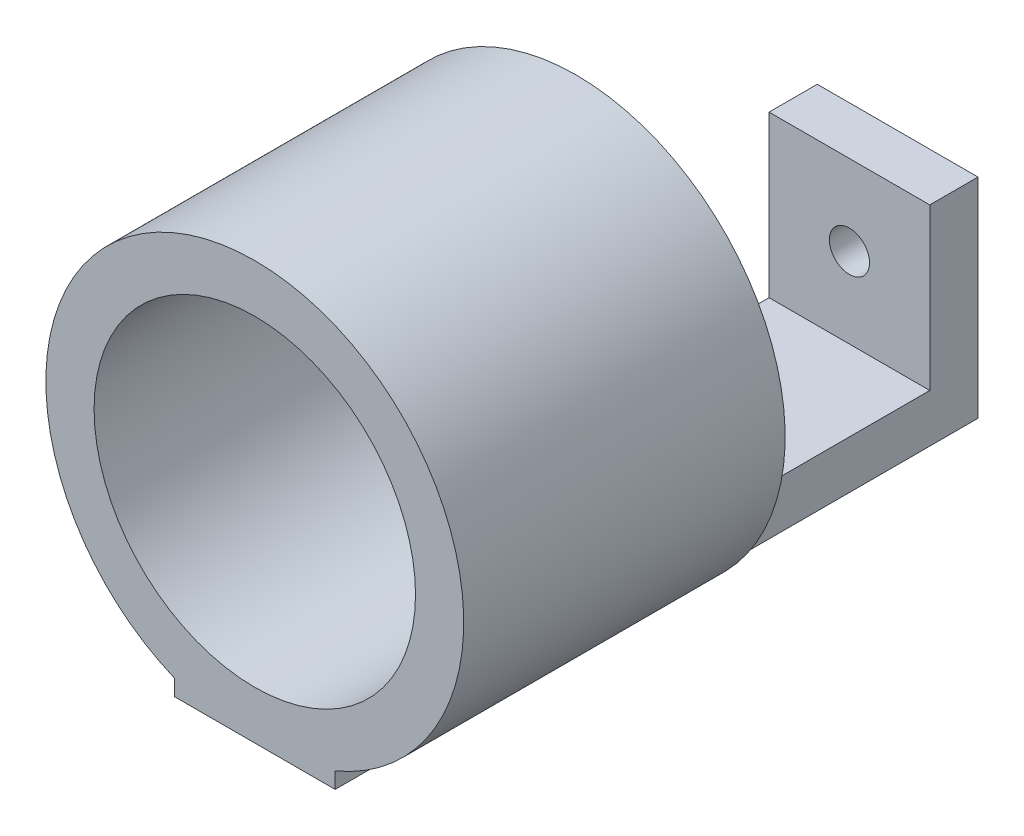
from build123d import *

# Parameters (mm, degrees)
SKETCH1_W           = 12.7
SKETCH1_H           = 50.8
BOSS_EXTRUDE1_DEPTH = 3.81
SKETCH2_R           = 16.51
SKETCH2_R_2         = 12.7
BOSS_EXTRUDE2_DEPTH = 25.4
SKETCH3_W           = 12.7
SKETCH3_H           = 12.7
SKETCH3_R           = 1.5875
BOSS_EXTRUDE3_DEPTH = 3.81


with BuildPart() as part:
    # Sketch1 → Boss-Extrude1 (new body)
    with BuildSketch(Plane(origin=(0, 0, 0), x_dir=(1, 0, 0), z_dir=(0, 1, 0))):
        with Locations((6.35, 25.4)):
            Rectangle(SKETCH1_W, SKETCH1_H)
    extrude(amount=BOSS_EXTRUDE1_DEPTH)

    # Sketch2 → Boss-Extrude2 (add)
    with BuildSketch(Plane.XY):
        with Locations((6.35, 16.51)):
            Circle(SKETCH2_R)
        with Locations((6.35, 16.51)):
            Circle(SKETCH2_R_2, mode=Mode.SUBTRACT)
    extrude(amount=-BOSS_EXTRUDE2_DEPTH)

    # Sketch3 → Boss-Extrude3 (add)
    with BuildSketch(Plane(origin=(0, 0, -50.8), x_dir=(-1, 0, 0), z_dir=(0, 0, -1))):
        with Locations((-6.35, 10.16)):
            Rectangle(SKETCH3_W, SKETCH3_H)
        with Locations((-6.35, 10.16)):
            Circle(SKETCH3_R, mode=Mode.SUBTRACT)
    extrude(amount=-BOSS_EXTRUDE3_DEPTH)


solid = part.part
